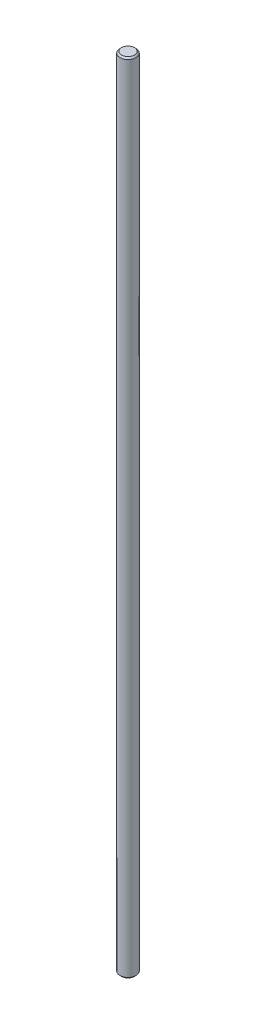
from build123d import *

# Parameters (mm, degrees)
SKETCH1_R           = 4
BOSS_EXTRUDE1_DEPTH = 400
CHAMFER1_SIZE       = 0.75


with BuildPart() as part:
    # Sketch1 → Boss-Extrude1 (new body)
    with BuildSketch(Plane(origin=(0, 0, 0), x_dir=(1, 0, 0), z_dir=(0, 1, 0))):
        with Locations(Location((0, 0, 0), (0, 0, 270))):
            Circle(SKETCH1_R)
    extrude(amount=BOSS_EXTRUDE1_DEPTH)

    # Chamfer1
    chamfer1_edges = [part.edges().sort_by_distance(p)[0] for p in [
        (0, 0, -4),
        (0, 400, -4),
    ]]
    chamfer(chamfer1_edges, length=CHAMFER1_SIZE)


solid = part.part
